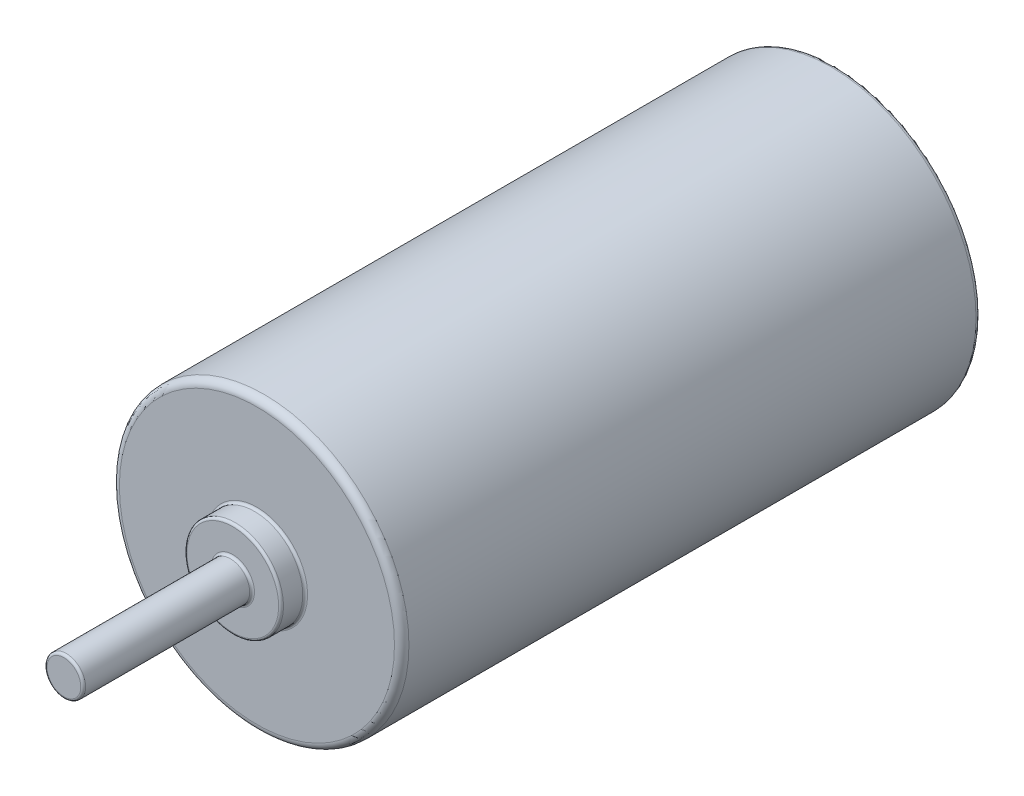
from build123d import *

# Parameters (mm, degrees)
FILLET1_R = 0.05
FILLET3_R = 0.15
FILLET4_R = 0.1


with BuildPart() as part:
    # Sketch1 → Revolve1 (revolve)
    with BuildSketch(Plane(origin=(0, 0, 0), x_dir=(0, 0, -1), z_dir=(1, 0, 0)), mode=Mode.PRIVATE) as revolve1_sk:
        Polygon((0, 3), (12, 3), (12, 0), (-4, 0), (-4, 0.4), (-0.5, 0.4), (-0.5, 1), (0, 1), align=None)
    revolve(revolve1_sk.sketch.rotate(Axis((0, 0, 94.83033259), (0, 0, -1)), 90), axis=Axis((0, 0, 94.83033259), (0, 0, -1)))

    # Fillet1
    fillet1_edges = [part.edges().sort_by_distance(p)[0] for p in [
        (-1, 0, 0),
        (-1, 0, 0.5),
        (-0.4, 0, 0.5),
        (-0.4, 0, 4),
    ]]
    fillet(fillet1_edges, radius=FILLET1_R)

    # Fillet3
    fillet3_edges = [part.edges().sort_by_distance(p)[0] for p in [
        (-3, 0, 0),
    ]]
    fillet(fillet3_edges, radius=FILLET3_R)

    # Fillet4
    fillet4_edges = [part.edges().sort_by_distance(p)[0] for p in [
        (-3, 0, -12),
    ]]
    fillet(fillet4_edges, radius=FILLET4_R)


solid = part.part
